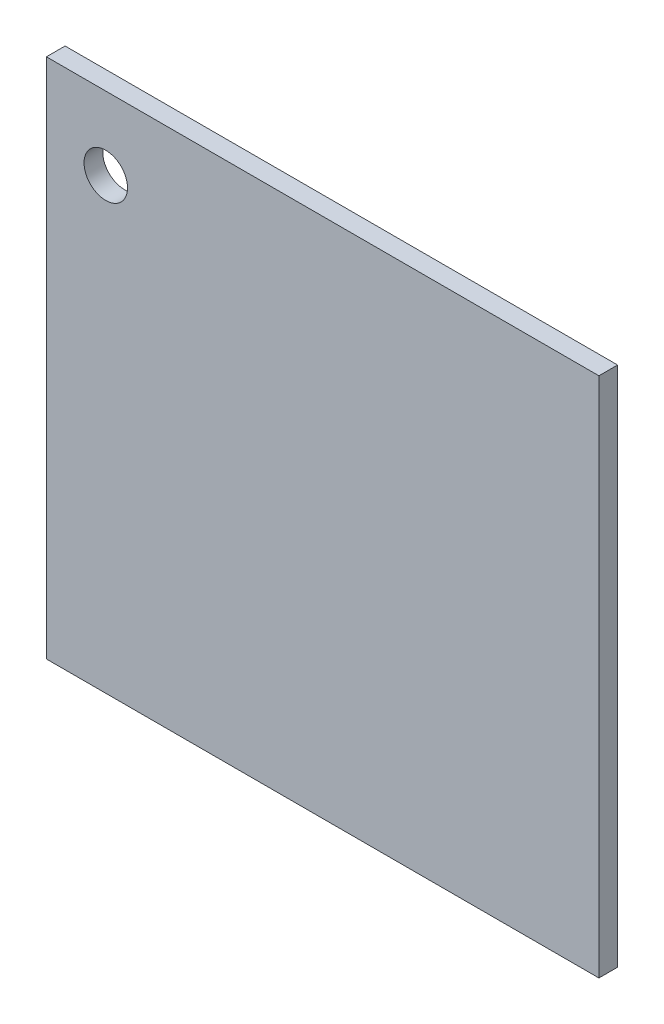
from build123d import *

# Parameters (mm, degrees)
SKETCH1_W           = 295.618826117
SKETCH1_H           = 279.049057448
BOSS_EXTRUDE1_DEPTH = 10
SKETCH2_R           = 11.632866943
CUT_EXTRUDE1_DEPTH  = 10


with BuildPart() as part:
    # Sketch1 → Boss-Extrude1 (new body)
    with BuildSketch(Plane.XY):
        with Locations((-82.197935831, 51.321553844)):
            Rectangle(SKETCH1_W, SKETCH1_H)
    extrude(amount=BOSS_EXTRUDE1_DEPTH)

    # Sketch2 → Cut-Extrude1 (cut)
    with BuildSketch(Plane.XY.offset(10)):
        with Locations((-198.245217344, 151.789338011)):
            Circle(SKETCH2_R)
    extrude(amount=-CUT_EXTRUDE1_DEPTH, mode=Mode.SUBTRACT)


solid = part.part
